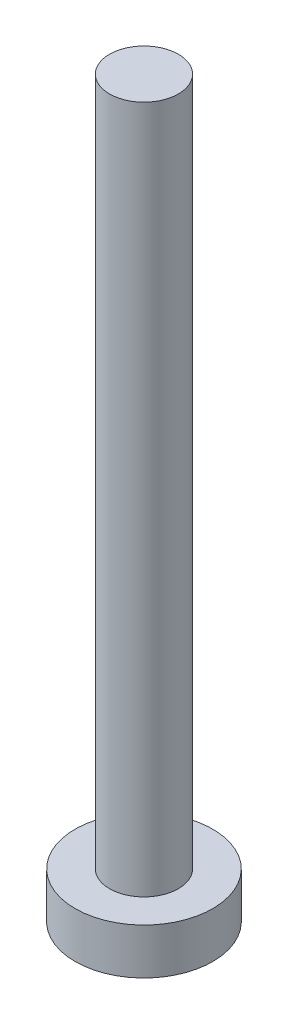
from build123d import *

# Parameters (mm, degrees)
SKETCH1_R           = 1.5
BOSS_EXTRUDE1_DEPTH = 30
SKETCH2_R           = 3
BOSS_EXTRUDE2_DEPTH = 2


with BuildPart() as part:
    # Sketch1 → Boss-Extrude1 (new body)
    with BuildSketch(Plane(origin=(0, 0, 0), x_dir=(1, 0, 0), z_dir=(0, 1, 0))):
        with Locations(Location((0, 0, 0), (0, 0, 270))):
            Circle(SKETCH1_R)
    extrude(amount=BOSS_EXTRUDE1_DEPTH)

    # Sketch2 → Boss-Extrude2 (add)
    with BuildSketch(Plane(origin=(0, 0, 0), x_dir=(1, 0, 0), z_dir=(0, 1, 0))):
        with Locations(Location((0, 0, 0), (0, 0, 270))):
            Circle(SKETCH2_R)
    extrude(amount=-BOSS_EXTRUDE2_DEPTH)


solid = part.part
